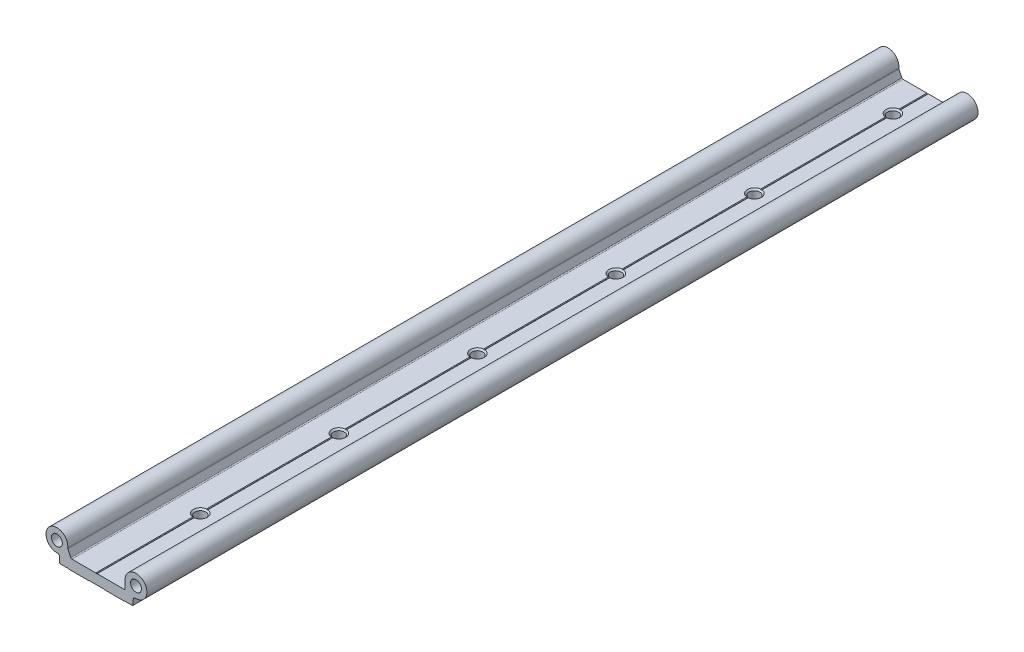
from build123d import *

# Parameters (mm, degrees)
MODEL_R                           = 3.999999997
BOSS_EXTRUDE1_DEPTH               = 609.6
F_3_8_16_TAPPED_HOLE1_D           = 7.9375
F_3_8_16_TAPPED_HOLE1_CSINK_D     = 10.16
F_3_8_16_TAPPED_HOLE1_CSINK_ANGLE = 90
CUT_EXTRUDE1_DEPTH                = 612.11795915
TAP_DRILL_FOR_0_80_TAP1_D         = 1.19126


with BuildPart() as part:
    # Model → Boss-Extrude1 (new body)
    with BuildSketch(Plane.XY):
        with BuildLine():
            Line((-18.843780991, 7.981867858), (-20.966888929, 12.534890876))
            ThreePointArc((-20.966888929, 12.534890876), (-21.047789267, 12.798072701), (-21.053849819, 13.07334131))
            ThreePointArc((-21.053849819, 13.07334131), (-34.474612004, 19.833405747), (-28.578947374, 6.011088019))
            ThreePointArc((-28.578947374, 6.011088019), (-27.4676292, 5.601381399), (-27.000000001, 4.513167022))
            Line((-27.000000001, 4.513167022), (-27.000000001, 0.700000022))
            Line((-27.000000001, 0.700000022), (-26.500000001, 0.200000022))
            Line((-26.500000001, 0.200000022), (-20.200001001, 0.200000022))
            Line((-20.200001001, 0.200000022), (-20.000000979, 0))
            Line((-20.000000979, 0), (-6.000000502, 0))
            Line((-6.000000502, 0), (-5.80000048, 0.200000022))
            Line((-5.80000048, 0.200000022), (5.80000048, 0.200000022))
            Line((5.80000048, 0.200000022), (6.000000502, 0))
            Line((6.000000502, 0), (20.000000979, 0))
            Line((20.000000979, 0), (20.200001001, 0.200000022))
            Line((20.200001001, 0.200000022), (26.500000001, 0.200000022))
            Line((26.500000001, 0.200000022), (27.000000001, 0.700000022))
            Line((27.000000001, 0.700000022), (27.000000001, 4.513167022))
            ThreePointArc((27.000000001, 4.513167022), (27.4676292, 5.601381399), (28.578947374, 6.011088019))
            ThreePointArc((28.578947374, 6.011088019), (34.474612004, 19.833405747), (21.053849819, 13.07334131))
            ThreePointArc((21.053849819, 13.07334131), (21.047789267, 12.798072701), (20.966888929, 12.534890876))
            Line((20.966888929, 12.534890876), (18.843780991, 7.981867858))
            ThreePointArc((18.843780991, 7.981867858), (18.479330527, 7.628755749), (17.98848008, 7.499999621))
            Line((17.98848008, 7.499999621), (0.500000254, 7.499999621))
            Line((0.500000254, 7.499999621), (0, 7.211324621))
            Line((0, 7.211324621), (-0.500000254, 7.499999621))
            Line((-0.500000254, 7.499999621), (-17.98848008, 7.499999621))
            ThreePointArc((-17.98848008, 7.499999621), (-18.479330527, 7.628755749), (-18.843780991, 7.981867858))
        make_face()
        with Locations(Location((-29.000000026, 13.999999962, 0), (0, 0, 180))):
            Circle(MODEL_R, mode=Mode.SUBTRACT)
        with Locations(Location((29.000000026, 13.999999962, 0), (0, 0, 180))):
            Circle(MODEL_R, mode=Mode.SUBTRACT)
    extrude(amount=BOSS_EXTRUDE1_DEPTH)

    # 3/8-16 Tapped Hole1 (through all)
    with Locations(Plane(origin=(0, 7.499999621, 0), x_dir=(1, 0, 0), z_dir=(0, 1, 0))):
        with Locations((0, -25.4), (0, -127), (0, -228.6), (0, -330.2), (0, -431.8), (0, -533.4), (0, -635), (0, -736.6), (0, -838.2), (0, -939.8), (0, -1041.4), (0, -1143), (0, -1244.6), (0, -1346.2), (0, -1447.8), (0, -1549.4), (0, -1651), (0, -1752.6), (0, -1854.2), (0, -1955.8)):
            CounterSinkHole(F_3_8_16_TAPPED_HOLE1_D / 2, F_3_8_16_TAPPED_HOLE1_CSINK_D / 2, counter_sink_angle=F_3_8_16_TAPPED_HOLE1_CSINK_ANGLE)

    # Sketch3 → Cut-Extrude1 (cut, through all)
    with BuildSketch(Plane(origin=(0, 0, 0), x_dir=(-1, 0, 0), z_dir=(0, 0, -1))):
        Polygon((-17.98848008, 7.499999621), (-21.053849819, 7.499999621), (-21.053849819, 13.07334131), align=None)
    extrude(amount=-CUT_EXTRUDE1_DEPTH, mode=Mode.SUBTRACT)

    # Tap Drill for #0-80 Tap1 (through all)
    with Locations(Plane(origin=(0, 7.499999621, 0), x_dir=(1, 0, 0), z_dir=(0, 1, 0))):
        with Locations((19.402849819, -3.309755123), (19.402849819, -103.055555123), (19.402849819, -202.801355123), (19.402849819, -302.547155123), (19.402849819, -402.292955123), (19.402849819, -502.038755123), (19.402849819, -601.784555123), (19.402849819, -701.530355123), (19.402849819, -801.276155123), (19.402849819, -901.021955123)):
            Hole(TAP_DRILL_FOR_0_80_TAP1_D / 2)


solid = part.part
